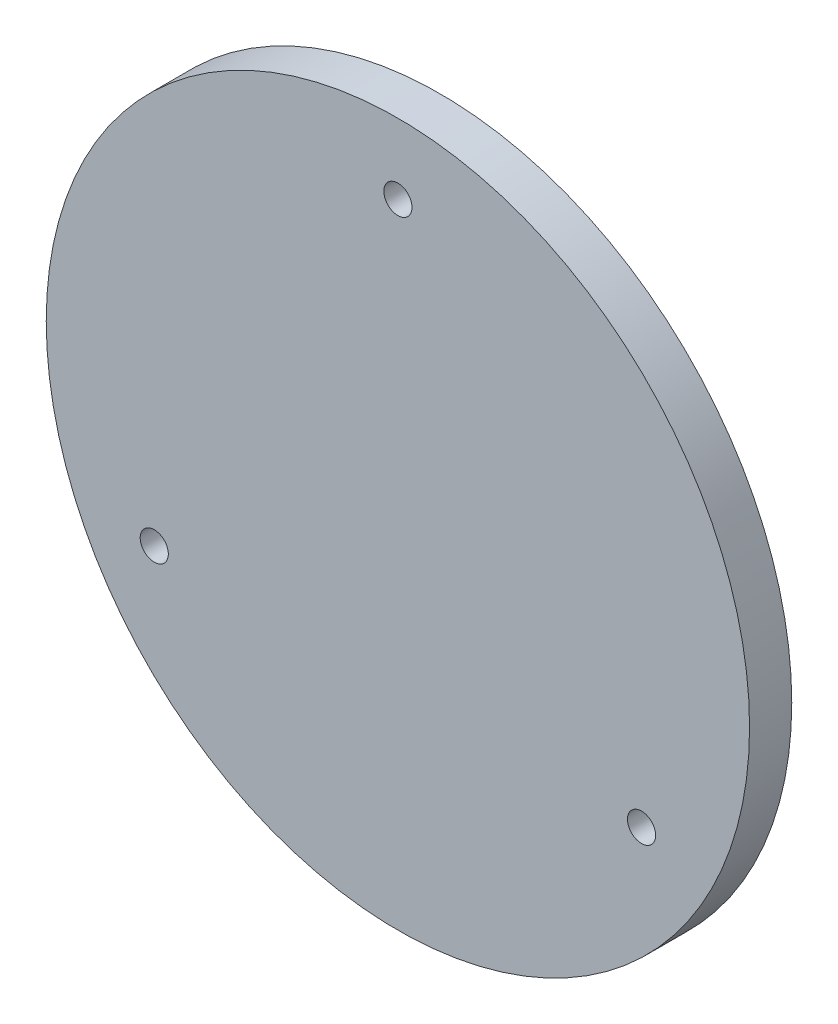
from build123d import *

# Parameters (mm, degrees)
SKETCH_1_R      = 25
SKETCH_1_R_2    = 1
EXTRUDE_1_DEPTH = 3


with BuildPart() as part:
    # 草图1 → 凸台-拉伸1 (new body)
    with BuildSketch(Plane.XY):
        Circle(SKETCH_1_R)
        with Locations((0, 20)):
            Circle(SKETCH_1_R_2, mode=Mode.SUBTRACT)
        with Locations((-17.320508076, -10)):
            Circle(SKETCH_1_R_2, mode=Mode.SUBTRACT)
        with Locations((17.320508076, -10)):
            Circle(SKETCH_1_R_2, mode=Mode.SUBTRACT)
    extrude(amount=EXTRUDE_1_DEPTH)


solid = part.part
